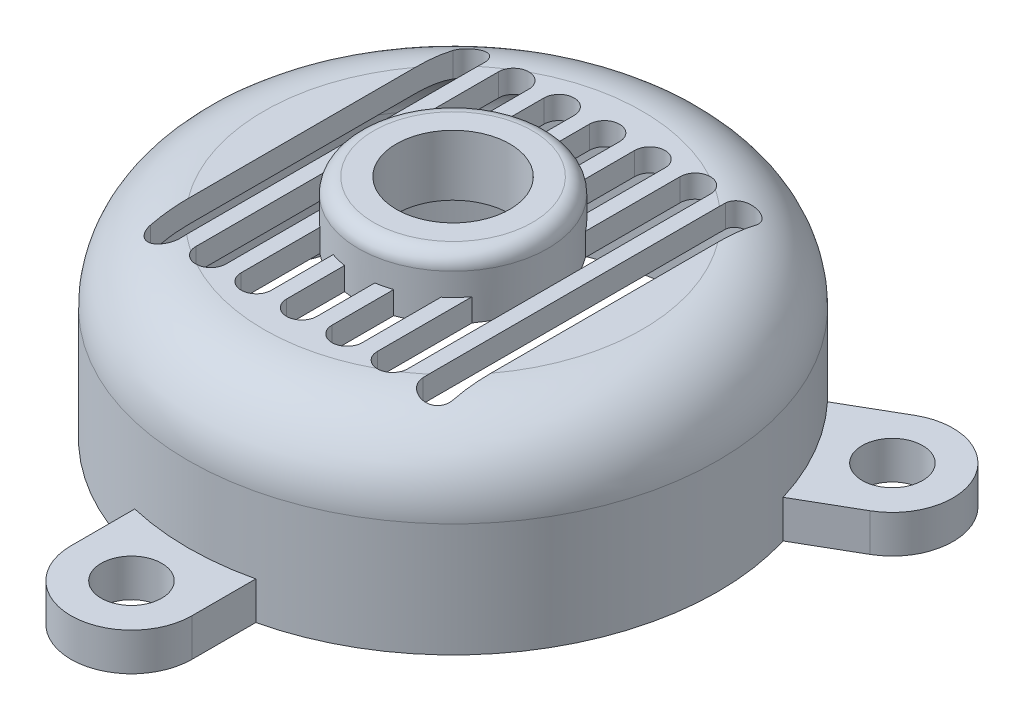
from build123d import *

# Parameters (mm, degrees)
SKETCH1_R                = 35
BOSS_EXTRUDE1_DEPTH      = 25
FILLET1_R                = 10
SHELL1_T                 = -3
SKETCH2_R                = 4
BOSS_EXTRUDE2_DEPTH      = 5
CIRPATTERN1_COUNT        = 3
CUT_EXTRUDE1_DEPTH       = 72.991907702
LPATTERN1_COUNT          = 7
LPATTERN1_PITCH          = 6
BOSS_EXTRUDE3_DEPTH      = 5
BOSS_EXTRUDE3_DEPTH_BACK = 3
SKETCH6_R                = 12.5
FILLET2_R                = 2
SKETCH7_R                = 7.5
CUT_EXTRUDE2_DEPTH       = 74.877160033


with BuildPart() as part:
    # Sketch1 → Boss-Extrude1 (new body)
    with BuildSketch(Plane(origin=(0, 0, 0), x_dir=(1, 0, 0), z_dir=(0, 1, 0))):
        with Locations(Location((0, 0, 0), (0, 0, 270))):
            Circle(SKETCH1_R)
    extrude(amount=BOSS_EXTRUDE1_DEPTH)

    # Fillet1
    fillet1_edges = [part.edges().sort_by_distance(p)[0] for p in [
        (0, 25, -35),
    ]]
    fillet(fillet1_edges, radius=FILLET1_R)

    # Shell1
    shell1_openings = [part.faces().sort_by_distance(p)[0] for p in [
        (0, 0, 0),
    ]]
    offset(amount=SHELL1_T, openings=shell1_openings, kind=Kind.INTERSECTION)

    # Sketch2 → Boss-Extrude2 (add)
    with BuildSketch(Plane.XZ):
        with BuildLine():
            Line((-8, 42.5), (-8, 32))
            Line((-8, 32), (8, 32))
            Line((8, 32), (8, 42.5))
            ThreePointArc((8, 42.5), (0, 50.5), (-8, 42.5))
        make_face()
        with Locations(Location((0, 42.5, 0), (0, 0, 270))):
            Circle(SKETCH2_R, mode=Mode.SUBTRACT)
    boss_extrude2 = extrude(amount=-BOSS_EXTRUDE2_DEPTH)

    # CirPattern1: Boss-Extrude2 ×3 about axis
    cirpattern1_axis = Axis((0, 0, 0), (0, 1, 0))
    for i in range(1, CIRPATTERN1_COUNT):
        add(boss_extrude2.rotate(cirpattern1_axis, i * 360 / CIRPATTERN1_COUNT))

    # Sketch4 → Cut-Extrude1 (cut, through all)
    with BuildSketch(Plane(origin=(0, 25, 0), x_dir=(1, 0, 0), z_dir=(0, 1, 0))):
        with BuildLine():
            Line((-16, 20), (-16, -20))
            ThreePointArc((-16, -20), (-18, -22), (-20, -20))
            Line((-20, -20), (-20, 20))
            ThreePointArc((-20, 20), (-18, 22), (-16, 20))
        make_face()
    cut_extrude1 = extrude(amount=-CUT_EXTRUDE1_DEPTH, mode=Mode.SUBTRACT)

    # LPattern1: Cut-Extrude1 ×7
    with Locations(*[(i * LPATTERN1_PITCH, 0, 0) for i in range(1, LPATTERN1_COUNT)]):
        add(cut_extrude1, mode=Mode.SUBTRACT)

    # Sketch6 → Boss-Extrude3 (add, two sides: drawn at the far end of the back side and taken through both)
    with BuildSketch(Plane(origin=(0, 25, 0), x_dir=(1, 0, 0), z_dir=(0, 1, 0)).offset(-BOSS_EXTRUDE3_DEPTH_BACK)):
        with Locations(Location((0, 0, 0), (0, 0, 270))):
            Circle(SKETCH6_R)
    extrude(amount=BOSS_EXTRUDE3_DEPTH + BOSS_EXTRUDE3_DEPTH_BACK)

    # Fillet2
    fillet2_edges = [part.edges().sort_by_distance(p)[0] for p in [
        (0, 30, -12.5),
    ]]
    fillet(fillet2_edges, radius=FILLET2_R)

    # Sketch7 → Cut-Extrude2 (cut, through all)
    with BuildSketch(Plane(origin=(0, 30, 0), x_dir=(1, 0, 0), z_dir=(0, 1, 0))):
        with Locations(Location((0, 0, 0), (0, 0, 270))):
            Circle(SKETCH7_R)
    extrude(amount=-CUT_EXTRUDE2_DEPTH, mode=Mode.SUBTRACT)


solid = part.part
